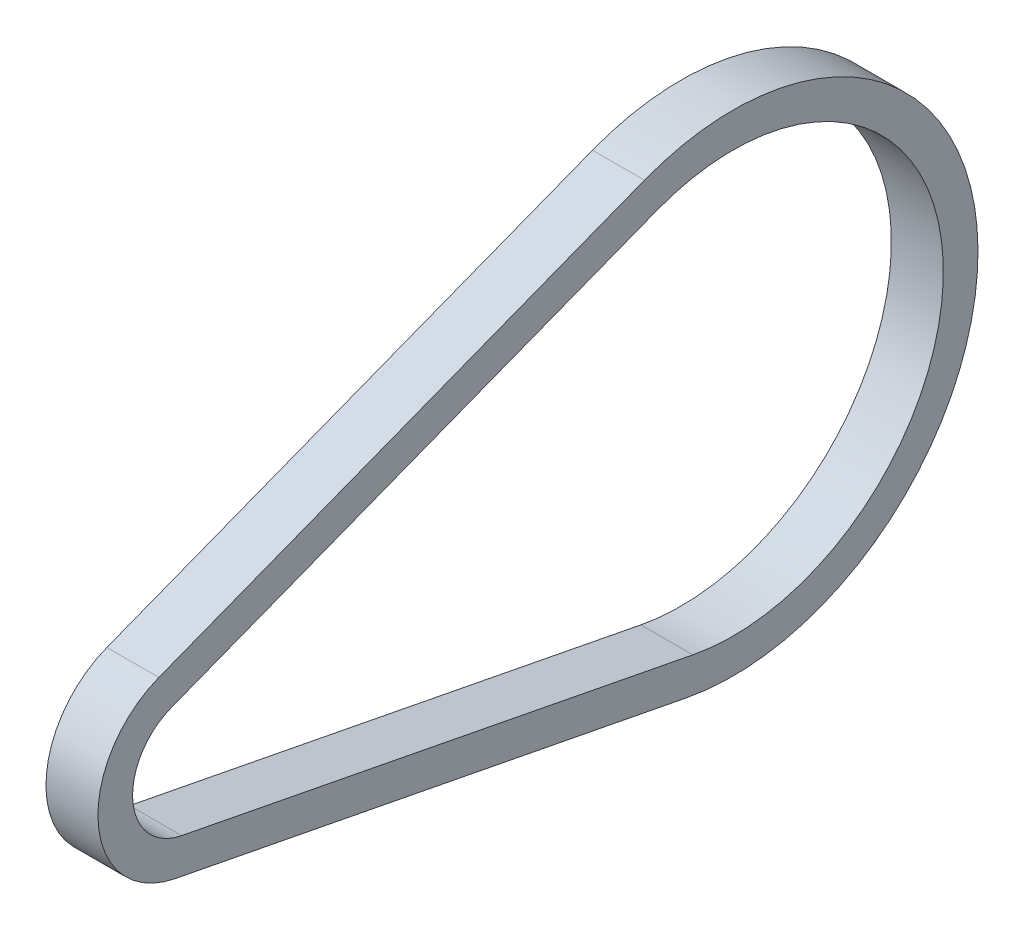
from build123d import *

# Parameters (mm, degrees)
EXTRUDE_THIN1_DEPTH = 9.525


with BuildPart() as part:
    # Sketch1 → Extrude-Thin1 (new, symmetric)
    with BuildSketch(Plane(origin=(110.25, 0, 0), x_dir=(0, 0, -1), z_dir=(1, 0, 0))):
        with BuildLine():
            Line((787.407234724, 304.620260153), (609.401622254, 235.773555274))
            ThreePointArc((609.401622254, 235.773555274), (587.21266904, 200.102060416), (615.355815938, 168.912823926))
            Line((615.355815938, 168.912823926), (802.725899606, 132.604166692))
            ThreePointArc((802.725899606, 132.604166692), (909.318920898, 228.786805134), (787.407234724, 304.620260153))
        make_face()
        with BuildLine():
            Line((791.988462996, 292.775330962), (613.982850525, 223.928626083))
            ThreePointArc((613.982850525, 223.928626083), (599.862607571, 201.228583901), (617.77188287, 181.380887953))
            Line((617.77188287, 181.380887953), (805.141966537, 145.072230719))
            ThreePointArc((805.141966537, 145.072230719), (896.668982367, 227.660281649), (791.988462996, 292.775330962))
        make_face(mode=Mode.SUBTRACT)
    extrude(amount=EXTRUDE_THIN1_DEPTH, both=True)


solid = part.part
